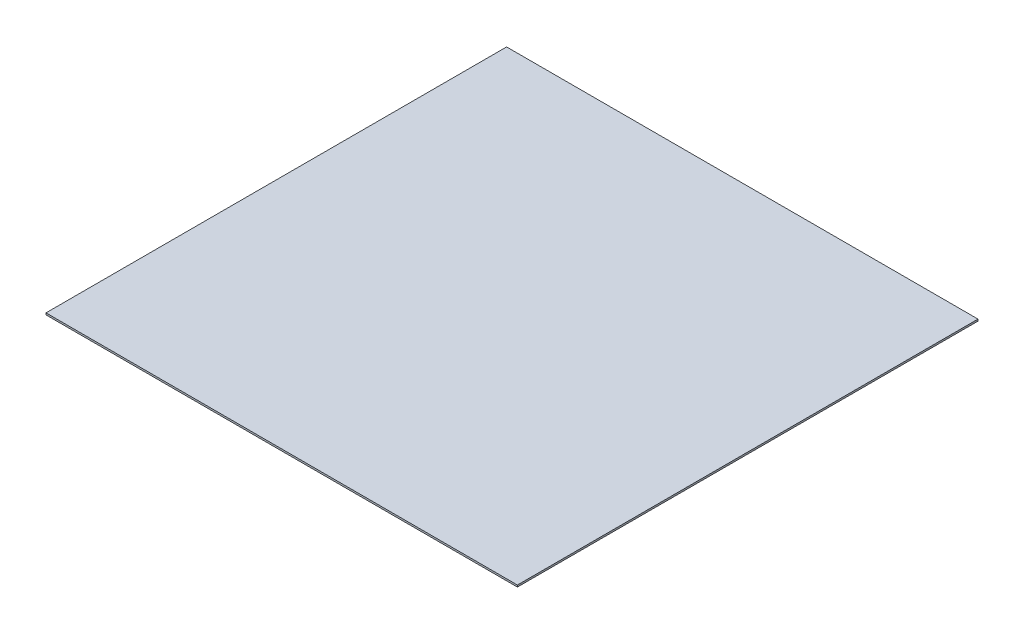
from build123d import *

# Parameters (mm, degrees)
SKETCH1_W           = 831.85
SKETCH1_H           = 812.8
BOSS_EXTRUDE1_DEPTH = 3.175


with BuildPart() as part:
    # Sketch1 → Boss-Extrude1 (new body)
    with BuildSketch(Plane(origin=(0, 0, 0), x_dir=(1, 0, 0), z_dir=(0, 1, 0))):
        with Locations((415.925, 406.4)):
            Rectangle(SKETCH1_W, SKETCH1_H)
    extrude(amount=BOSS_EXTRUDE1_DEPTH)


solid = part.part
